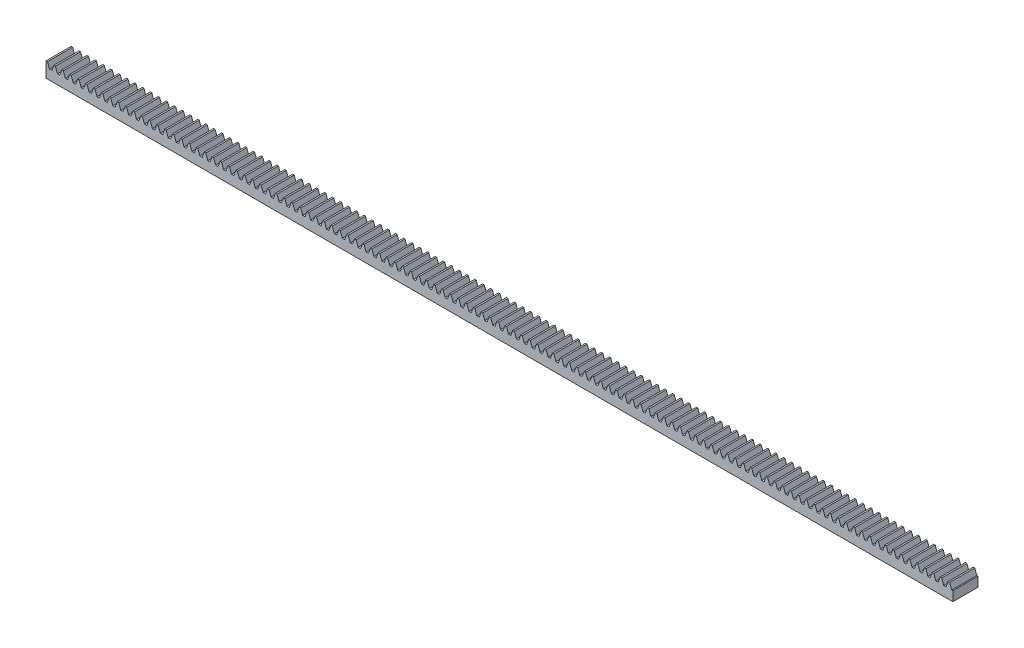
from build123d import *

# Parameters (mm, degrees)
BOSS_EXTRUDE1_DEPTH = 6.35


with BuildPart() as part:
    # Sketch1 → Boss-Extrude1 (new body)
    with BuildSketch(Plane.XY):
        Polygon((0, 0), (-228.6, 0), (-228.6, 3.81), (-228.225940865, 3.81), (-227.717474448, 2.413), (-227.122309419, 2.413), (-226.613843002, 3.81), (-226.231029533, 3.81), (-225.722563115, 2.413), (-225.127398086, 2.413), (-224.618931669, 3.81), (-224.2361182, 3.81), (-223.727651783, 2.413), (-223.132486753, 2.413), (-222.624020336, 3.81), (-222.241206867, 3.81), (-221.73274045, 2.413), (-221.137575421, 2.413), (-220.629109003, 3.81), (-220.246295534, 3.81), (-219.737829117, 2.413), (-219.142664088, 2.413), (-218.634197671, 3.81), (-218.251384202, 3.81), (-217.742917784, 2.413), (-217.147752755, 2.413), (-216.639286338, 3.81), (-216.256472869, 3.81), (-215.748006452, 2.413), (-215.152841422, 2.413), (-214.644375005, 3.81), (-214.261561536, 3.81), (-213.753095119, 2.413), (-213.15793009, 2.413), (-212.649463672, 3.81), (-212.266650203, 3.81), (-211.758183786, 2.413), (-211.163018757, 2.413), (-210.65455234, 3.81), (-210.271738871, 3.81), (-209.763272453, 2.413), (-209.168107424, 2.413), (-208.659641007, 3.81), (-208.276827538, 3.81), (-207.768361121, 2.413), (-207.173196091, 2.413), (-206.664729674, 3.81), (-206.281916205, 3.81), (-205.773449788, 2.413), (-205.178284759, 2.413), (-204.669818341, 3.81), (-204.287004872, 3.81), (-203.778538455, 2.413), (-203.183373426, 2.413), (-202.674907009, 3.81), (-202.29209354, 3.81), (-201.783627122, 2.413), (-201.188462093, 2.413), (-200.679995676, 3.81), (-200.297182207, 3.81), (-199.78871579, 2.413), (-199.19355076, 2.413), (-198.685084343, 3.81), (-198.302270874, 3.81), (-197.793804457, 2.413), (-197.198639428, 2.413), (-196.69017301, 3.81), (-196.307359541, 3.81), (-195.798893124, 2.413), (-195.203728095, 2.413), (-194.695261678, 3.81), (-194.312448209, 3.81), (-193.803981791, 2.413), (-193.208816762, 2.413), (-192.700350345, 3.81), (-192.317536876, 3.81), (-191.809070459, 2.413), (-191.213905429, 2.413), (-190.705439012, 3.81), (-190.322625543, 3.81), (-189.814159126, 2.413), (-189.218994097, 2.413), (-188.710527679, 3.81), (-188.32771421, 3.81), (-187.819247793, 2.413), (-187.224082764, 2.413), (-186.715616347, 3.81), (-186.332802878, 3.81), (-185.82433646, 2.413), (-185.229171431, 2.413), (-184.720705014, 3.81), (-184.337891545, 3.81), (-183.829425128, 2.413), (-183.234260098, 2.413), (-182.725793681, 3.81), (-182.342980212, 3.81), (-181.834513795, 2.413), (-181.239348766, 2.413), (-180.730882348, 3.81), (-180.348068879, 3.81), (-179.839602462, 2.413), (-179.244437433, 2.413), (-178.735971016, 3.81), (-178.353157547, 3.81), (-177.844691129, 2.413), (-177.2495261, 2.413), (-176.741059683, 3.81), (-176.358246214, 3.81), (-175.849779797, 2.413), (-175.254614767, 2.413), (-174.74614835, 3.81), (-174.363334881, 3.81), (-173.854868464, 2.413), (-173.259703435, 2.413), (-172.751237017, 3.81), (-172.368423548, 3.81), (-171.859957131, 2.413), (-171.264792102, 2.413), (-170.756325685, 3.81), (-170.373512216, 3.81), (-169.865045798, 2.413), (-169.269880769, 2.413), (-168.761414352, 3.81), (-168.378600883, 3.81), (-167.870134466, 2.413), (-167.274969436, 2.413), (-166.766503019, 3.81), (-166.38368955, 3.81), (-165.875223133, 2.413), (-165.280058104, 2.413), (-164.771591686, 3.81), (-164.388778217, 3.81), (-163.8803118, 2.413), (-163.285146771, 2.413), (-162.776680354, 3.81), (-162.393866885, 3.81), (-161.885400467, 2.413), (-161.290235438, 2.413), (-160.781769021, 3.81), (-160.398955552, 3.81), (-159.890489135, 2.413), (-159.295324105, 2.413), (-158.786857688, 3.81), (-158.404044219, 3.81), (-157.895577802, 2.413), (-157.300412773, 2.413), (-156.791946355, 3.81), (-156.409132886, 3.81), (-155.900666469, 2.413), (-155.30550144, 2.413), (-154.797035023, 3.81), (-154.414221554, 3.81), (-153.905755136, 2.413), (-153.310590107, 2.413), (-152.80212369, 3.81), (-152.419310221, 3.81), (-151.910843804, 2.413), (-151.315678774, 2.413), (-150.807212357, 3.81), (-150.424398888, 3.81), (-149.915932471, 2.413), (-149.320767442, 2.413), (-148.812301024, 3.81), (-148.429487555, 3.81), (-147.921021138, 2.413), (-147.325856109, 2.413), (-146.817389692, 3.81), (-146.434576223, 3.81), (-145.926109805, 2.413), (-145.330944776, 2.413), (-144.822478359, 3.81), (-144.43966489, 3.81), (-143.931198473, 2.413), (-143.336033443, 2.413), (-142.827567026, 3.81), (-142.444753557, 3.81), (-141.93628714, 2.413), (-141.341122111, 2.413), (-140.832655693, 3.81), (-140.449842224, 3.81), (-139.941375807, 2.413), (-139.346210778, 2.413), (-138.837744361, 3.81), (-138.454930892, 3.81), (-137.946464474, 2.413), (-137.351299445, 2.413), (-136.842833028, 3.81), (-136.460019559, 3.81), (-135.951553142, 2.413), (-135.356388112, 2.413), (-134.847921695, 3.81), (-134.465108226, 3.81), (-133.956641809, 2.413), (-133.36147678, 2.413), (-132.853010362, 3.81), (-132.470196893, 3.81), (-131.961730476, 2.413), (-131.366565447, 2.413), (-130.85809903, 3.81), (-130.475285561, 3.81), (-129.966819143, 2.413), (-129.371654114, 2.413), (-128.863187697, 3.81), (-128.480374228, 3.81), (-127.971907811, 2.413), (-127.376742781, 2.413), (-126.868276364, 3.81), (-126.485462895, 3.81), (-125.976996478, 2.413), (-125.381831449, 2.413), (-124.873365031, 3.81), (-124.490551562, 3.81), (-123.982085145, 2.413), (-123.386920116, 2.413), (-122.878453699, 3.81), (-122.49564023, 3.81), (-121.987173812, 2.413), (-121.392008783, 2.413), (-120.883542366, 3.81), (-120.500728897, 3.81), (-119.99226248, 2.413), (-119.39709745, 2.413), (-118.888631033, 3.81), (-118.505817564, 3.81), (-117.997351147, 2.413), (-117.402186118, 2.413), (-116.8937197, 3.81), (-116.510906231, 3.81), (-116.002439814, 2.413), (-115.407274785, 2.413), (-114.898808368, 3.81), (-114.515994899, 3.81), (-114.007528481, 2.413), (-113.412363452, 2.413), (-112.903897035, 3.81), (-112.521083566, 3.81), (-112.012617149, 2.413), (-111.417452119, 2.413), (-110.908985702, 3.81), (-110.526172233, 3.81), (-110.017705816, 2.413), (-109.422540787, 2.413), (-108.914074369, 3.81), (-108.5312609, 3.81), (-108.022794483, 2.413), (-107.427629454, 2.413), (-106.919163037, 3.81), (-106.536349568, 3.81), (-106.02788315, 2.413), (-105.432718121, 2.413), (-104.924251704, 3.81), (-104.541438235, 3.81), (-104.032971818, 2.413), (-103.437806788, 2.413), (-102.929340371, 3.81), (-102.546526902, 3.81), (-102.038060485, 2.413), (-101.442895456, 2.413), (-100.934429038, 3.81), (-100.551615569, 3.81), (-100.043149152, 2.413), (-99.447984123, 2.413), (-98.939517706, 3.81), (-98.556704237, 3.81), (-98.048237819, 2.413), (-97.45307279, 2.413), (-96.944606373, 3.81), (-96.561792904, 3.81), (-96.053326487, 2.413), (-95.458161457, 2.413), (-94.94969504, 3.81), (-94.566881571, 3.81), (-94.058415154, 2.413), (-93.463250125, 2.413), (-92.954783707, 3.81), (-92.571970238, 3.81), (-92.063503821, 2.413), (-91.468338792, 2.413), (-90.959872375, 3.81), (-90.577058906, 3.81), (-90.068592488, 2.413), (-89.473427459, 2.413), (-88.964961042, 3.81), (-88.582147573, 3.81), (-88.073681156, 2.413), (-87.478516126, 2.413), (-86.970049709, 3.81), (-86.58723624, 3.81), (-86.078769823, 2.413), (-85.483604794, 2.413), (-84.975138376, 3.81), (-84.592324907, 3.81), (-84.08385849, 2.413), (-83.488693461, 2.413), (-82.980227044, 3.81), (-82.597413575, 3.81), (-82.088947157, 2.413), (-81.493782128, 2.413), (-80.985315711, 3.81), (-80.602502242, 3.81), (-80.094035825, 2.413), (-79.498870795, 2.413), (-78.990404378, 3.81), (-78.607590909, 3.81), (-78.099124492, 2.413), (-77.503959463, 2.413), (-76.995493045, 3.81), (-76.612679576, 3.81), (-76.104213159, 2.413), (-75.50904813, 2.413), (-75.000581713, 3.81), (-74.617768244, 3.81), (-74.109301826, 2.413), (-73.514136797, 2.413), (-73.00567038, 3.81), (-72.622856911, 3.81), (-72.114390494, 2.413), (-71.519225464, 2.413), (-71.010759047, 3.81), (-70.627945578, 3.81), (-70.119479161, 2.413), (-69.524314132, 2.413), (-69.015847714, 3.81), (-68.633034245, 3.81), (-68.124567828, 2.413), (-67.529402799, 2.413), (-67.020936382, 3.81), (-66.638122913, 3.81), (-66.129656495, 2.413), (-65.534491466, 2.413), (-65.026025049, 3.81), (-64.64321158, 3.81), (-64.134745163, 2.413), (-63.539580133, 2.413), (-63.031113716, 3.81), (-62.648300247, 3.81), (-62.13983383, 2.413), (-61.544668801, 2.413), (-61.036202383, 3.81), (-60.653388914, 3.81), (-60.144922497, 2.413), (-59.549757468, 2.413), (-59.041291051, 3.81), (-58.658477582, 3.81), (-58.150011164, 2.413), (-57.554846135, 2.413), (-57.046379718, 3.81), (-56.663566249, 3.81), (-56.155099832, 2.413), (-55.559934802, 2.413), (-55.051468385, 3.81), (-54.668654916, 3.81), (-54.160188499, 2.413), (-53.56502347, 2.413), (-53.056557052, 3.81), (-52.673743583, 3.81), (-52.165277166, 2.413), (-51.570112137, 2.413), (-51.06164572, 3.81), (-50.678832251, 3.81), (-50.170365833, 2.413), (-49.575200804, 2.413), (-49.066734387, 3.81), (-48.683920918, 3.81), (-48.175454501, 2.413), (-47.580289471, 2.413), (-47.071823054, 3.81), (-46.689009585, 3.81), (-46.180543168, 2.413), (-45.585378139, 2.413), (-45.076911721, 3.81), (-44.694098252, 3.81), (-44.185631835, 2.413), (-43.590466806, 2.413), (-43.082000389, 3.81), (-42.69918692, 3.81), (-42.190720502, 2.413), (-41.595555473, 2.413), (-41.087089056, 3.81), (-40.704275587, 3.81), (-40.19580917, 2.413), (-39.60064414, 2.413), (-39.092177723, 3.81), (-38.709364254, 3.81), (-38.200897837, 2.413), (-37.605732808, 2.413), (-37.09726639, 3.81), (-36.714452921, 3.81), (-36.205986504, 2.413), (-35.610821475, 2.413), (-35.102355058, 3.81), (-34.719541589, 3.81), (-34.211075171, 2.413), (-33.615910142, 2.413), (-33.107443725, 3.81), (-32.724630256, 3.81), (-32.216163839, 2.413), (-31.620998809, 2.413), (-31.112532392, 3.81), (-30.729718923, 3.81), (-30.221252506, 2.413), (-29.626087477, 2.413), (-29.117621059, 3.81), (-28.73480759, 3.81), (-28.226341173, 2.413), (-27.631176144, 2.413), (-27.122709727, 3.81), (-26.739896258, 3.81), (-26.23142984, 2.413), (-25.636264811, 2.413), (-25.127798394, 3.81), (-24.744984925, 3.81), (-24.236518508, 2.413), (-23.641353478, 2.413), (-23.132887061, 3.81), (-22.750073592, 3.81), (-22.241607175, 2.413), (-21.646442146, 2.413), (-21.137975728, 3.81), (-20.755162259, 3.81), (-20.246695842, 2.413), (-19.651530813, 2.413), (-19.143064396, 3.81), (-18.760250927, 3.81), (-18.251784509, 2.413), (-17.65661948, 2.413), (-17.148153063, 3.81), (-16.765339594, 3.81), (-16.256873177, 2.413), (-15.661708147, 2.413), (-15.15324173, 3.81), (-14.770428261, 3.81), (-14.261961844, 2.413), (-13.666796815, 2.413), (-13.158330397, 3.81), (-12.775516928, 3.81), (-12.267050511, 2.413), (-11.671885482, 2.413), (-11.163419065, 3.81), (-10.780605596, 3.81), (-10.272139178, 2.413), (-9.676974149, 2.413), (-9.168507732, 3.81), (-8.785694263, 3.81), (-8.277227846, 2.413), (-7.682062816, 2.413), (-7.173596399, 3.81), (-6.79078293, 3.81), (-6.282316513, 2.413), (-5.687151484, 2.413), (-5.178685066, 3.81), (-4.795871597, 3.81), (-4.28740518, 2.413), (-3.692240151, 2.413), (-3.183773734, 3.81), (-2.800960265, 3.81), (-2.292493847, 2.413), (-1.697328818, 2.413), (-1.188862401, 3.81), (-0.806048932, 3.81), (-0.297582515, 2.413), (0, 2.413), align=None)
    extrude(amount=BOSS_EXTRUDE1_DEPTH)


solid = part.part
